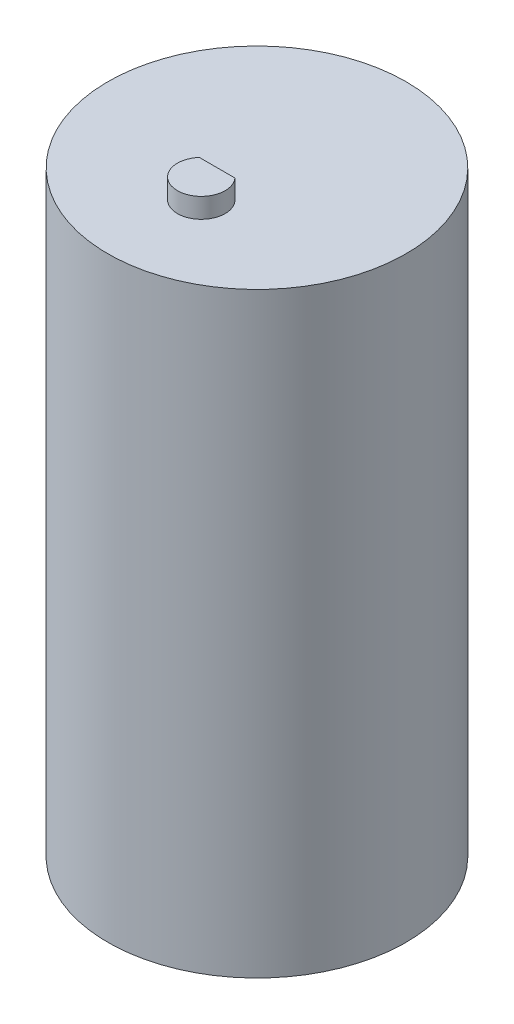
from build123d import *

# Parameters (mm, degrees)
SKETCH1_R           = 19.05
BOSS_EXTRUDE1_DEPTH = 76.2
BOSS_EXTRUDE3_DEPTH = 2.54


with BuildPart() as part:
    # Sketch1 → Boss-Extrude1 (new body)
    with BuildSketch(Plane(origin=(0, 0, 0), x_dir=(1, 0, 0), z_dir=(0, 1, 0))):
        with Locations(Location((0, 0, 0), (0, 0, 90))):
            Circle(SKETCH1_R)
    extrude(amount=BOSS_EXTRUDE1_DEPTH)

    # Sketch2 → Boss-Extrude3 (add)
    with BuildSketch(Plane(origin=(0, 76.2, 0), x_dir=(1, 0, 0), z_dir=(0, 1, 0))):
        with BuildLine():
            Line((2.273328114, -5.081659317), (0, -5.081659317))
            Line((0, -5.081659317), (-2.273328114, -5.081659317))
            ThreePointArc((-2.273328114, -5.081659317), (-1.086554166, -9.959754211), (3.048, -7.112))
            ThreePointArc((3.048, -7.112), (2.847754211, -6.025445834), (2.273328114, -5.081659317))
        make_face()
    extrude(amount=BOSS_EXTRUDE3_DEPTH)


solid = part.part
